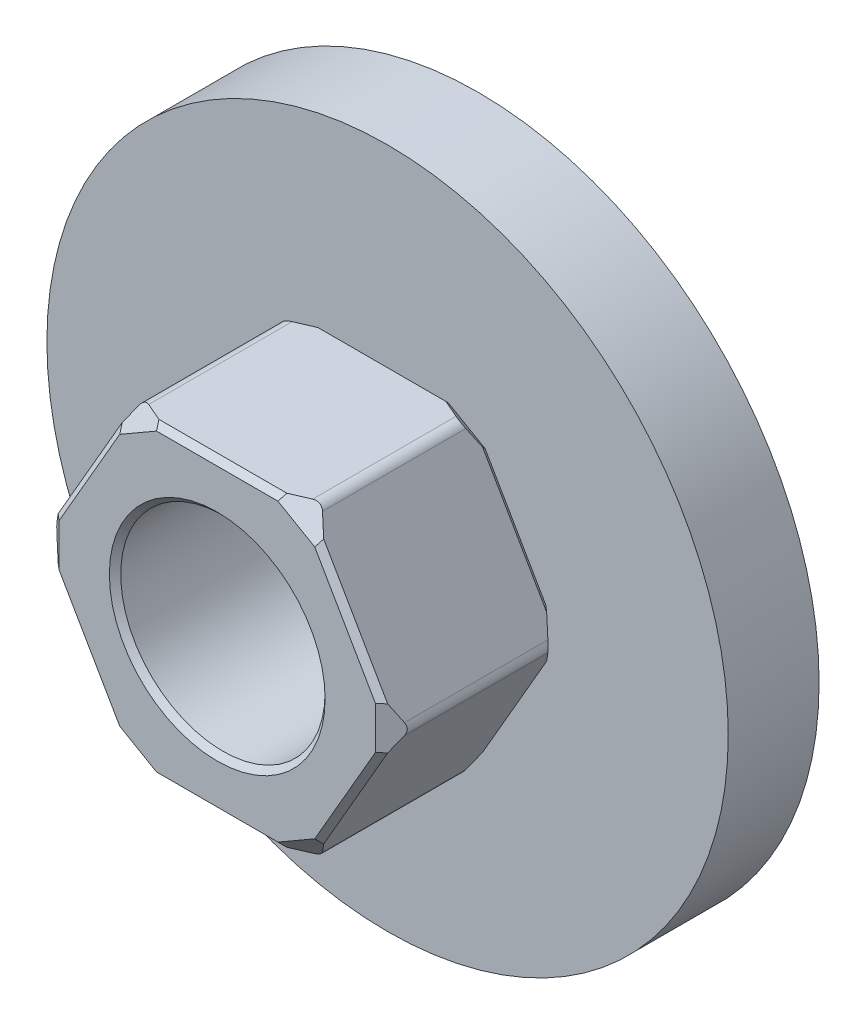
from build123d import *

# Parameters (mm, degrees)
SKETCH1_R           = 9
BOSS_EXTRUDE1_DEPTH = 15
CHAMFER1_SIZE       = 0.5
CHAMFER2_SIZE       = 2
FILLET1_R           = 1
SKETCH2_R           = 30
SKETCH2_R_2         = 9
BOSS_EXTRUDE2_DEPTH = 8


with BuildPart() as part:
    # Sketch1 → Boss-Extrude1 (new body)
    with BuildSketch(Plane.XY):
        Polygon((-7.794228634, 13.5), (-15.588457268, 0), (-7.794228634, -13.5), (7.794228634, -13.5), (15.588457268, 0), (7.794228634, 13.5), align=None)
        Circle(SKETCH1_R, mode=Mode.SUBTRACT)
    extrude(amount=BOSS_EXTRUDE1_DEPTH)

    # Chamfer1
    chamfer1_edges = [part.edges().sort_by_distance(p)[0] for p in [
        (-11.691342951, -6.75, 15),
        (0, -13.5, 15),
        (-9, 0, 0),
        (-9, 0, 15),
        (11.691342951, -6.75, 15),
        (11.691342951, 6.75, 15),
        (0, 13.5, 15),
        (11.691342951, 6.75, 0),
        (11.691342951, -6.75, 0),
        (0, -13.5, 0),
        (-11.691342951, -6.75, 0),
        (-11.691342951, 6.75, 0),
        (0, 13.5, 0),
        (-11.691342951, 6.75, 15),
    ]]
    chamfer(chamfer1_edges, length=CHAMFER1_SIZE)

    # Chamfer2
    chamfer2_edges = [part.edges().sort_by_distance(p)[0] for p in [
        (15.299782134, 0, 0.25),
        (7.649891067, -13.25, 0.25),
        (7.649891067, 13.25, 0.25),
        (-7.649891067, -13.25, 0.25),
        (-7.649891067, 13.25, 0.25),
        (-15.299782134, 0, 0.25),
        (-7.649891067, -13.25, 14.75),
        (-15.299782134, 0, 14.75),
        (7.649891067, -13.25, 14.75),
        (-7.649891067, 13.25, 14.75),
        (15.299782134, 0, 14.75),
        (7.649891067, 13.25, 14.75),
    ]]
    chamfer(chamfer2_edges, length=CHAMFER2_SIZE)

    # Fillet1
    fillet1_edges = [part.edges().sort_by_distance(p)[0] for p in [
        (-15.588457268, 0, 7.5),
        (-7.794228634, -13.5, 7.5),
        (-7.794228634, 13.5, 7.5),
        (7.794228634, -13.5, 7.5),
        (15.588457268, 0, 7.5),
        (7.794228634, 13.5, 7.5),
    ]]
    fillet(fillet1_edges, radius=FILLET1_R)


with BuildPart() as body_2:
    # Sketch2 → Boss-Extrude2 (new body)
    with BuildSketch(Plane(origin=(0, 0, 0), x_dir=(-1, 0, 0), z_dir=(0, 0, -1))):
        Circle(SKETCH2_R)
        Circle(SKETCH2_R_2, mode=Mode.SUBTRACT)
    extrude(amount=BOSS_EXTRUDE2_DEPTH)


solid = Compound([part.part, body_2.part])
